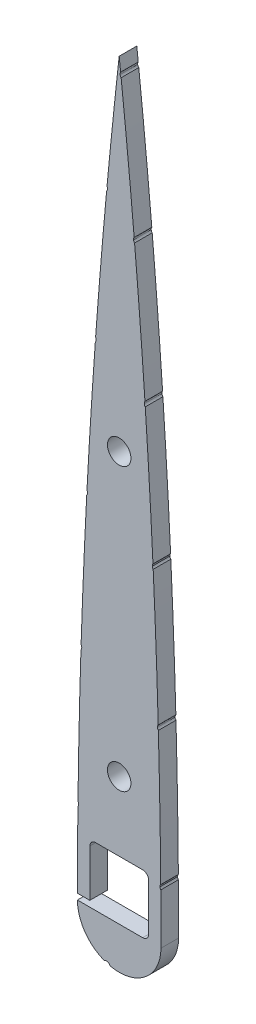
from build123d import *

# Parameters (mm, degrees)
BOSS_EXTRUDE1_DEPTH = 3
CUT_EXTRUDE1_DEPTH  = 10
SKETCH3_R           = 2
SKETCH3_W           = 13.226446019
SKETCH3_H           = 1
CUT_EXTRUDE2_DEPTH  = 10


with BuildPart() as part:
    # Sketch1 → Boss-Extrude1 (new body)
    with BuildSketch(Plane.XY):
        with BuildLine():
            ThreePointArc((13.121375015, 488.277822844), (20.226638173, 481.172559686), (27.331901331, 488.277822844))
            ThreePointArc((27.331901331, 488.277822844), (25.554217038, 552.323799448), (20.226638173, 616.172559686))
            ThreePointArc((20.226638173, 616.172559686), (14.899059308, 552.323799448), (13.121375015, 488.277822844))
        make_face()
        with BuildLine():
            Line((24.226638173, 498.277822844), (16.226638173, 498.277822844))
            ThreePointArc((16.226638173, 498.277822844), (15.519531392, 497.984929625), (15.226638173, 497.277822844))
            Line((15.226638173, 497.277822844), (15.226638173, 489.277822844))
            ThreePointArc((15.226638173, 489.277822844), (15.519531392, 488.570716063), (16.226638173, 488.277822844))
            Line((16.226638173, 488.277822844), (24.226638173, 488.277822844))
            ThreePointArc((24.226638173, 488.277822844), (24.933744954, 488.570716063), (25.226638173, 489.277822844))
            Line((25.226638173, 489.277822844), (25.226638173, 497.277822844))
            ThreePointArc((25.226638173, 497.277822844), (24.933744954, 497.984929625), (24.226638173, 498.277822844))
        make_face(mode=Mode.SUBTRACT)
    extrude(amount=BOSS_EXTRUDE1_DEPTH)

    # Sketch2 → Cut-Extrude1 (cut)
    with BuildSketch(Plane.XY.offset(3)):
        with BuildLine():
            add(Edge.make_bspline(
                [(17.917824518, 480.550113994), (17.879049958, 480.563442129), (17.802525035, 480.589746348), (17.700711898, 480.655079034), (17.613238362, 480.738836562), (17.545617647, 480.840833441), (17.493803609, 480.952626823), (17.46890122, 481.072139339), (17.466402269, 481.194948135), (17.484272992, 481.275029918), (17.493388754, 481.315879218)],
                knots=[0, 0, 0, 0, 1.008999505, 1.991347132, 2.958476684, 3.977839497, 4.99441976, 5.98108309, 6.970161017, 8, 8, 8, 8], degree=3))
            add(Edge.make_bspline(
                [(17.493388754, 481.315879218), (17.506651104, 481.355170807), (17.532681405, 481.432289255), (17.598326154, 481.534540464), (17.682504029, 481.621874617), (17.783956316, 481.69109152), (17.895791033, 481.744135072), (18.014247189, 481.770965238), (18.135773557, 481.773081444), (18.214356613, 481.755353058), (18.254701855, 481.746251147)],
                knots=[0, 0, 0, 0, 1.021718546, 2.005348997, 2.9737415, 4.001367881, 5.024329172, 6.014925073, 6.980844817, 8, 8, 8, 8], degree=3))
            add(Edge.make_bspline(
                [(18.254701855, 481.746251147), (18.293932401, 481.732914986), (18.370283672, 481.706959884), (18.473505916, 481.642576018), (18.558267104, 481.555970566), (18.627081129, 481.454225867), (18.678678349, 481.342206622), (18.703534333, 481.223247245), (18.706140424, 481.101401964), (18.688260927, 481.022321881), (18.679137619, 480.981969964)],
                knots=[0, 0, 0, 0, 1.021990589, 1.98901847, 2.974808984, 3.995774727, 5.013953546, 6.002168387, 6.980573457, 8, 8, 8, 8], degree=3))
            add(Edge.make_bspline(
                [(18.679137619, 480.981969964), (18.665887345, 480.942178578), (18.639888953, 480.864103812), (18.574138528, 480.760572371), (18.490936683, 480.671419911), (18.388361369, 480.603905112), (18.277067295, 480.552137248), (18.15860809, 480.527593086), (18.037272116, 480.522614474), (17.958178639, 480.540823569), (17.917824518, 480.550113994)],
                knots=[0, 0, 0, 0, 1.031014283, 2.022955405, 2.998173182, 4.016768215, 5.032582796, 6.006578686, 6.982940593, 8, 8, 8, 8], degree=3))
        make_face()
        with BuildLine():
            add(Edge.make_bspline(
                [(12.091373886, 502.515681823), (12.093603678, 502.557001147), (12.097956816, 502.63766729), (12.133858983, 502.753359861), (12.191443599, 502.85915034), (12.269765202, 502.95320184), (12.364691341, 503.032011191), (12.471639915, 503.09091371), (12.590515736, 503.124616642), (12.672412485, 503.129195965), (12.714671162, 503.131558893)],
                knots=[0, 0, 0, 0, 1.01693019, 1.985314115, 2.956688424, 3.970102348, 4.983516273, 5.982145833, 6.958788392, 8, 8, 8, 8], degree=3))
            add(Edge.make_bspline(
                [(12.714671162, 503.131558893), (12.755956195, 503.129235023), (12.837029544, 503.12467153), (12.953873331, 503.089727928), (13.059282663, 503.029755894), (13.153603649, 502.951311839), (13.233570108, 502.858169839), (13.290959536, 502.751817819), (13.326952331, 502.63619858), (13.33129294, 502.555522299), (13.333516314, 502.514197782)],
                knots=[0, 0, 0, 0, 1.02132407, 2.005621777, 2.98709575, 4.004888363, 5.030536525, 6.00610788, 6.97867593, 8, 8, 8, 8], degree=3))
            add(Edge.make_bspline(
                [(13.333516314, 502.514197782), (13.331279369, 502.472880608), (13.326912267, 502.392218662), (13.29091072, 502.275848024), (13.232270162, 502.169386904), (13.152004867, 502.075274232), (13.057276131, 501.996989014), (12.950061977, 501.940847348), (12.83423812, 501.904646933), (12.753033199, 501.901437983), (12.711703079, 501.899804753)],
                knots=[0, 0, 0, 0, 1.019629596, 1.990584061, 2.981129565, 4.005076079, 5.03062764, 5.998806182, 6.981470843, 8, 8, 8, 8], degree=3))
            add(Edge.make_bspline(
                [(12.711703079, 501.899804753), (12.669436737, 501.902154035), (12.587525132, 501.906706912), (12.469406662, 501.940414543), (12.362554173, 501.998058405), (12.268335909, 502.07676095), (12.189598312, 502.170978758), (12.132317493, 502.277445596), (12.09836365, 502.393944264), (12.093744215, 502.474398867), (12.091373886, 502.515681823)],
                knots=[0, 0, 0, 0, 1.042416427, 2.020189091, 3.003435257, 4.018021836, 5.032608414, 6.01585458, 6.981893087, 8, 8, 8, 8], degree=3))
        make_face()
        with BuildLine():
            add(Edge.make_bspline(
                [(12.615406431, 525.845411658), (12.618801455, 525.886715869), (12.625433091, 525.96739703), (12.66174154, 526.083296308), (12.722903929, 526.187039287), (12.803351203, 526.278510248), (12.898174869, 526.356136985), (13.007433105, 526.409914552), (13.125969731, 526.442813961), (13.208307444, 526.445215481), (13.250576035, 526.446448316)],
                knots=[0, 0, 0, 0, 1.021067248, 1.994491294, 2.968604708, 3.972804607, 4.989479518, 5.972662446, 6.959253296, 8, 8, 8, 8], degree=3))
            add(Edge.make_bspline(
                [(13.250576035, 526.446448316), (13.291980385, 526.44389581), (13.373063073, 526.438897204), (13.487956379, 526.398882027), (13.594630178, 526.341086822), (13.686084091, 526.258357139), (13.765181542, 526.164113637), (13.821316677, 526.056348462), (13.853688708, 525.939313992), (13.856244353, 525.858477249), (13.857548858, 525.817214876)],
                knots=[0, 0, 0, 0, 1.020907315, 1.999256392, 2.97913271, 4.001796173, 5.02737987, 6.0064165, 6.982393634, 8, 8, 8, 8], degree=3))
            add(Edge.make_bspline(
                [(13.857548858, 525.817214876), (13.854118603, 525.77593238), (13.847418148, 525.695293636), (13.811532933, 525.578845511), (13.747889324, 525.47549723), (13.667199257, 525.382470295), (13.570696884, 525.305935301), (13.462304306, 525.250795637), (13.344933757, 525.218669174), (13.263633818, 525.216032249), (13.222379254, 525.214694176)],
                knots=[0, 0, 0, 0, 1.021360064, 1.995063264, 2.975640288, 3.997365632, 5.023900495, 5.996453334, 6.983327114, 8, 8, 8, 8], degree=3))
            add(Edge.make_bspline(
                [(13.222379254, 525.214694176), (13.18060513, 525.218154472), (13.098530613, 525.22495299), (12.980442981, 525.2606142), (12.87503604, 525.322292477), (12.781799735, 525.401655399), (12.70590743, 525.498032027), (12.652166577, 525.606239462), (12.619143679, 525.723267742), (12.616669402, 525.804134146), (12.615406431, 525.845411658)],
                knots=[0, 0, 0, 0, 1.031706484, 2.027015891, 3.010296948, 4.022279364, 5.029916433, 6.011683584, 6.985082168, 8, 8, 8, 8], degree=3))
        make_face()
        with BuildLine():
            add(Edge.make_bspline(
                [(13.606882641, 549.157394072), (13.61050287, 549.198821617), (13.617555371, 549.279525856), (13.658930742, 549.393436738), (13.718026376, 549.498439676), (13.802722732, 549.587600135), (13.89965487, 549.663040053), (14.009789128, 549.716318352), (14.129003878, 549.747523504), (14.21168844, 549.747866988), (14.253924575, 549.748042443)],
                knots=[0, 0, 0, 0, 1.020248997, 1.987528327, 2.959402107, 3.968455721, 4.99450988, 5.97004364, 6.963077158, 8, 8, 8, 8], degree=3))
            add(Edge.make_bspline(
                [(14.253924575, 549.748042443), (14.295359071, 549.744470101), (14.3767077, 549.737456499), (14.491305331, 549.694850431), (14.596133504, 549.633327149), (14.686809598, 549.550048214), (14.76212584, 549.453397304), (14.817658477, 549.345627001), (14.84828348, 549.227854072), (14.848775294, 549.146678627), (14.849025069, 549.105452632)],
                knots=[0, 0, 0, 0, 1.022883536, 2.008234237, 2.988801837, 4.00949426, 5.028503638, 6.001047132, 6.98480605, 8, 8, 8, 8], degree=3))
            add(Edge.make_bspline(
                [(14.849025069, 549.105452632), (14.845334939, 549.064068062), (14.838146264, 548.983447539), (14.797583199, 548.868451099), (14.733953821, 548.764796952), (14.649962025, 548.673925045), (14.551216728, 548.600126489), (14.44238683, 548.546301165), (14.32420056, 548.517376979), (14.243187657, 548.51665534), (14.201983135, 548.516288303)],
                knots=[0, 0, 0, 0, 1.022392895, 1.991704816, 2.97809575, 4.006523517, 5.027383862, 6.004967558, 6.985293002, 8, 8, 8, 8], degree=3))
            add(Edge.make_bspline(
                [(14.201983135, 548.516288303), (14.160102242, 548.520000322), (14.078044037, 548.527273367), (13.962145796, 548.567529424), (13.856467187, 548.627986833), (13.766229965, 548.710996512), (13.691658409, 548.808305708), (13.638891308, 548.917271794), (13.607472072, 549.034922325), (13.607081167, 549.116144397), (13.606882641, 549.157394072)],
                knots=[0, 0, 0, 0, 1.033502729, 2.024965853, 2.997943477, 4.01716331, 5.027289332, 6.003931093, 6.986270707, 8, 8, 8, 8], degree=3))
        make_face()
        with BuildLine():
            add(Edge.make_bspline(
                [(15.071347074, 572.448169717), (15.076034197, 572.489122878), (15.085240891, 572.569565248), (15.129034887, 572.682716348), (15.191772101, 572.785968487), (15.277063415, 572.87368057), (15.375654984, 572.947149598), (15.486812131, 572.997978807), (15.607150692, 573.02638599), (15.68955234, 573.024793233), (15.731745378, 573.023977676)],
                knots=[0, 0, 0, 0, 1.012095049, 1.988010731, 2.962326238, 3.971185869, 4.983060649, 5.975809561, 6.963531105, 8, 8, 8, 8], degree=3))
            add(Edge.make_bspline(
                [(15.731745378, 573.023977676), (15.772695171, 573.019844619), (15.853666013, 573.011672242), (15.967393915, 572.968049095), (16.07169558, 572.904703235), (16.159612527, 572.818319683), (16.235099909, 572.720505416), (16.285491162, 572.609791124), (16.316307396, 572.491886874), (16.314439261, 572.410760261), (16.313489502, 572.369515537)],
                knots=[0, 0, 0, 0, 1.011577617, 2.000212631, 2.975800792, 4.003234938, 5.023684605, 6.006651877, 6.986582949, 8, 8, 8, 8], degree=3))
            add(Edge.make_bspline(
                [(16.313489502, 572.369515537), (16.308768307, 572.3285845), (16.299494685, 572.248185589), (16.256094192, 572.134470175), (16.19090965, 572.031645616), (16.105325796, 571.942396281), (16.00583114, 571.87007679), (15.895521104, 571.819261138), (15.777135444, 571.791892597), (15.695764138, 571.792112317), (15.65457524, 571.792223536)],
                knots=[0, 0, 0, 0, 1.014338011, 1.992416476, 2.975366335, 4.003734179, 5.027738349, 5.995383679, 6.985294169, 8, 8, 8, 8], degree=3))
            add(Edge.make_bspline(
                [(15.65457524, 571.792223536), (15.612631062, 571.796862611), (15.530719595, 571.805922113), (15.415598435, 571.849865844), (15.311048749, 571.912681471), (15.221073433, 571.997524427), (15.149097559, 572.097614223), (15.097227415, 572.207538697), (15.069063712, 572.326063196), (15.070576756, 572.406975656), (15.071347074, 572.448169717)],
                knots=[0, 0, 0, 0, 1.033942708, 2.019154198, 3.001733942, 4.017266702, 5.036798354, 6.016361729, 6.990092289, 8, 8, 8, 8], degree=3))
        make_face()
        with BuildLine():
            add(Edge.make_bspline(
                [(17.002280489, 595.702331369), (17.007517398, 595.74327257), (17.017816513, 595.823789177), (17.062354574, 595.937230853), (17.129122654, 596.038234352), (17.215528238, 596.125678014), (17.316728143, 596.195942739), (17.428410248, 596.24713545), (17.549891808, 596.270945069), (17.632432917, 596.268830196), (17.674551122, 596.267751041)],
                knots=[0, 0, 0, 0, 1.011145168, 1.988558624, 2.962868331, 3.968519099, 4.990202991, 5.975070542, 6.966740416, 8, 8, 8, 8], degree=3))
            add(Edge.make_bspline(
                [(17.674551122, 596.267751041), (17.71548942, 596.261919577), (17.795917658, 596.250462961), (17.909640728, 596.20584612), (18.01254618, 596.139638029), (18.099557237, 596.051621731), (18.173364349, 595.952858352), (18.221333161, 595.840996232), (18.248183798, 595.722404998), (18.245687706, 595.641120172), (18.244422917, 595.599932531)],
                knots=[0, 0, 0, 0, 1.016206121, 1.996459845, 2.983813118, 4.009625526, 5.03137357, 6.00302407, 6.988117089, 8, 8, 8, 8], degree=3))
            add(Edge.make_bspline(
                [(18.244422917, 595.599932531), (18.239334264, 595.558931211), (18.229304326, 595.47811596), (18.182496393, 595.365385365), (18.115845603, 595.263330676), (18.028589119, 595.17587929), (17.927811117, 595.103857349), (17.815215406, 595.058527573), (17.696696985, 595.030032197), (17.615346573, 595.033975221), (17.573636325, 595.035996901)],
                knots=[0, 0, 0, 0, 1.013875973, 1.998390303, 2.975331333, 4.000933858, 5.025377018, 6.003229941, 6.97620956, 8, 8, 8, 8], degree=3))
            add(Edge.make_bspline(
                [(17.573636325, 595.035996901), (17.531701583, 595.041183989), (17.449710097, 595.051325869), (17.334339883, 595.096036959), (17.231907687, 595.16281282), (17.142944458, 595.248782602), (17.072709735, 595.349819337), (17.023244183, 595.460937911), (16.99906036, 595.580097574), (17.001196658, 595.661189916), (17.002280489, 595.702331369)],
                knots=[0, 0, 0, 0, 1.034864822, 2.023384443, 3.007637215, 4.02174498, 5.043180155, 6.011779463, 6.991294619, 8, 8, 8, 8], degree=3))
        make_face()
        with BuildLine():
            add(Edge.make_bspline(
                [(21.606151704, 613.674996608), (21.60824702, 613.633894764), (21.61234275, 613.553552693), (21.591043714, 613.434225918), (21.543460235, 613.323282489), (21.475648278, 613.221526407), (21.390146424, 613.134120644), (21.290357202, 613.066048459), (21.177869381, 613.018068853), (21.09707154, 613.004990902), (21.055572444, 612.998273851)],
                knots=[0, 0, 0, 0, 1.016949119, 1.987837794, 2.97078766, 3.986776939, 5.000399666, 5.979064506, 6.962014372, 8, 8, 8, 8], degree=3))
            add(Edge.make_bspline(
                [(21.055572444, 612.998273851), (21.01441884, 612.995347455), (20.933406678, 612.989586751), (20.814641652, 613.014494272), (20.701370834, 613.057411293), (20.599291949, 613.126022291), (20.510344024, 613.211197792), (20.441011175, 613.310375134), (20.39263371, 613.421459007), (20.380557239, 613.500908976), (20.374397564, 613.541432906)],
                knots=[0, 0, 0, 0, 1.017996937, 2.003958949, 2.978494688, 4.00553413, 5.028760475, 6.015179833, 6.987630671, 8, 8, 8, 8], degree=3))
            add(Edge.make_bspline(
                [(20.374397564, 613.541432906), (20.372361955, 613.58252227), (20.368358793, 613.663327274), (20.388974946, 613.782859245), (20.43744973, 613.893544054), (20.505382701, 613.994863493), (20.589981435, 614.084407232), (20.691222858, 614.150964067), (20.802535161, 614.19998991), (20.882449171, 614.212972091), (20.923492783, 614.219639703)],
                knots=[0, 0, 0, 0, 1.017406399, 2.000798258, 2.972896542, 3.98934267, 5.012198053, 6.00145414, 6.973552424, 8, 8, 8, 8], degree=3))
            add(Edge.make_bspline(
                [(20.923492783, 614.219639703), (20.965125547, 614.22251944), (21.047088091, 614.228188787), (21.167242725, 614.204004556), (21.280182374, 614.1590981), (21.380813943, 614.089880916), (21.470869179, 614.007205514), (21.537830591, 613.906977627), (21.586451994, 613.795930518), (21.599467154, 613.716032174), (21.606151704, 613.674996608)],
                knots=[0, 0, 0, 0, 1.027989449, 2.023805788, 3.000729072, 4.015307955, 5.02781928, 6.005125536, 6.975438043, 8, 8, 8, 8], degree=3))
        make_face()
        with BuildLine():
            add(Edge.make_bspline(
                [(23.913246578, 590.445978184), (23.914999924, 590.404817499), (23.918456, 590.323684347), (23.89324309, 590.204989639), (23.846262384, 590.093024335), (23.774947284, 589.992462323), (23.687352429, 589.905325709), (23.585035347, 589.838114574), (23.470452404, 589.791973547), (23.38830646, 589.780865863), (23.346342865, 589.775191593)],
                knots=[0, 0, 0, 0, 1.008647345, 1.988177229, 2.95197647, 3.973427005, 4.996033518, 5.970120688, 6.963052491, 8, 8, 8, 8], degree=3))
            add(Edge.make_bspline(
                [(23.346342865, 589.775191593), (23.304682173, 589.773367409), (23.223531054, 589.769814071), (23.103772787, 589.795602654), (22.991845632, 589.843323653), (22.889826392, 589.91325777), (22.802498303, 590.000181645), (22.734212249, 590.101135937), (22.688132131, 590.214542912), (22.676839385, 590.295197288), (22.67110415, 590.336159141)],
                knots=[0, 0, 0, 0, 1.022927375, 1.99256653, 2.985553801, 4.002228239, 5.018319052, 6.001173918, 6.984858293, 8, 8, 8, 8], degree=3))
            add(Edge.make_bspline(
                [(22.67110415, 590.336159141), (22.669116282, 590.377855941), (22.665239205, 590.459180125), (22.69330296, 590.578078589), (22.740425812, 590.689734347), (22.812775169, 590.789959943), (22.900420366, 590.876536871), (23.001133882, 590.945734207), (23.115269876, 590.989490644), (23.195623501, 591.001057935), (23.236523821, 591.006945733)],
                knots=[0, 0, 0, 0, 1.02389329, 1.996970653, 2.979695845, 3.994259616, 5.019965172, 6.003748113, 6.983899731, 8, 8, 8, 8], degree=3))
            add(Edge.make_bspline(
                [(23.236523821, 591.006945733), (23.278678304, 591.008735193), (23.361293311, 591.012242206), (23.481876877, 590.986888251), (23.595139141, 590.940422949), (23.69554526, 590.868636616), (23.783282334, 590.782021249), (23.851971168, 590.681307666), (23.89580812, 590.567247868), (23.907364389, 590.486883813), (23.913246578, 590.445978184)],
                knots=[0, 0, 0, 0, 1.032197202, 2.022916011, 2.997199867, 4.017903909, 5.031140257, 6.011234028, 6.987710091, 8, 8, 8, 8], degree=3))
        make_face()
        with BuildLine():
            add(Edge.make_bspline(
                [(25.738228963, 567.186671986), (25.738873867, 567.145494627), (25.740138872, 567.064723548), (25.713882202, 566.946266594), (25.663801041, 566.835606841), (25.590842634, 566.736689848), (25.503547692, 566.649008974), (25.397961399, 566.587411181), (25.28369066, 566.540983295), (25.201467722, 566.532230356), (25.159452921, 566.527757723)],
                knots=[0, 0, 0, 0, 1.010400582, 1.981942197, 2.956907825, 3.976937045, 4.992528012, 5.975587291, 6.965552691, 8, 8, 8, 8], degree=3))
            add(Edge.make_bspline(
                [(25.159452921, 566.527757723), (25.118291601, 566.52716845), (25.037067441, 566.52600563), (24.917914464, 566.551733299), (24.806835131, 566.602729167), (24.705895285, 566.674464337), (24.6200562, 566.764216549), (24.555335943, 566.867352135), (24.509658913, 566.980409756), (24.50065862, 567.061094409), (24.496086535, 567.102081641)],
                knots=[0, 0, 0, 0, 1.011507555, 1.996020843, 2.972054622, 4.003110375, 5.028608614, 6.008815604, 6.988492445, 8, 8, 8, 8], degree=3))
            add(Edge.make_bspline(
                [(24.496086535, 567.102081641), (24.495309044, 567.143280847), (24.493781912, 567.224203409), (24.522048579, 567.342654065), (24.57335244, 567.452497499), (24.64672496, 567.551497781), (24.73547721, 567.636927492), (24.838688002, 567.70250054), (24.953138982, 567.745263762), (25.033954591, 567.754723464), (25.074862577, 567.759511863)],
                knots=[0, 0, 0, 0, 1.013640227, 1.990969597, 2.97415334, 3.987572963, 5.015233372, 5.99750704, 6.986359773, 8, 8, 8, 8], degree=3))
            add(Edge.make_bspline(
                [(25.074862577, 567.759511863), (25.117014327, 567.760123582), (25.199712926, 567.76132373), (25.320352211, 567.735732586), (25.431833285, 567.685026642), (25.530870565, 567.612184459), (25.617841382, 567.524957862), (25.680484497, 567.421168113), (25.724349934, 567.3080807), (25.733546829, 567.227629594), (25.738228963, 567.186671986)],
                knots=[0, 0, 0, 0, 1.034989411, 2.030572227, 3.005778869, 4.026060244, 5.041902269, 6.014827011, 6.989349644, 8, 8, 8, 8], degree=3))
        make_face()
        with BuildLine():
            add(Edge.make_bspline(
                [(27.096672228, 543.894651202), (27.096933189, 543.85344065), (27.097446396, 543.772395696), (27.068040961, 543.654257149), (27.01435272, 543.545395916), (26.94090788, 543.447315489), (26.851005738, 543.363478048), (26.745979152, 543.301963361), (26.630235363, 543.259719101), (26.547942391, 543.25267927), (26.506023858, 543.24909331)],
                knots=[0, 0, 0, 0, 1.012278585, 1.990753993, 2.966492828, 3.985426641, 4.994692376, 5.972940029, 6.967452766, 8, 8, 8, 8], degree=3))
            add(Edge.make_bspline(
                [(26.506023858, 543.24909331), (26.464786582, 543.248774866), (26.383689074, 543.248148613), (26.265705272, 543.278438226), (26.155187653, 543.329132871), (26.056604123, 543.403923999), (25.972998035, 543.494382627), (25.908449567, 543.597709237), (25.867301517, 543.712250018), (25.858825393, 543.792921986), (25.8545298, 543.833805516)],
                knots=[0, 0, 0, 0, 1.014190945, 1.994514854, 2.977876179, 3.998734926, 5.027161082, 6.003140339, 6.98801686, 8, 8, 8, 8], degree=3))
            add(Edge.make_bspline(
                [(25.8545298, 543.833805516), (25.854882907, 543.875021101), (25.855577156, 543.956055754), (25.884701247, 544.074083278), (25.937721708, 544.183433269), (26.014415369, 544.279754008), (26.103871975, 544.364778278), (26.208985915, 544.425817942), (26.322889547, 544.46868998), (26.403731461, 544.476726975), (26.445178171, 544.48084745)],
                knots=[0, 0, 0, 0, 1.015073626, 1.995753275, 2.973690186, 3.992578788, 5.02137814, 6.001829521, 6.975561218, 8, 8, 8, 8], degree=3))
            add(Edge.make_bspline(
                [(26.445178171, 544.48084745), (26.487368166, 544.48049907), (26.569843587, 544.479818037), (26.689597045, 544.451123157), (26.798944757, 544.397054849), (26.896980178, 544.323155577), (26.981894784, 544.234421127), (27.043777708, 544.130201906), (27.085860196, 544.016400265), (27.093037746, 543.935577347), (27.096672228, 543.894651202)],
                knots=[0, 0, 0, 0, 1.037286792, 2.027747689, 3.003623852, 4.022701075, 5.040392144, 6.008318064, 6.991475854, 8, 8, 8, 8], degree=3))
        make_face()
        with BuildLine():
            add(Edge.make_bspline(
                [(27.982077934, 520.579388591), (27.981443594, 520.538100636), (27.980200381, 520.457182286), (27.946683392, 520.340243413), (27.893155997, 520.231929298), (27.816700118, 520.135677114), (27.724704856, 520.055035434), (27.619398395, 519.993196903), (27.502196032, 519.955554832), (27.419889838, 519.949022074), (27.378073193, 519.945703027)],
                knots=[0, 0, 0, 0, 1.014078848, 1.987446149, 2.969181748, 3.976786433, 4.996715222, 5.969394658, 6.968326673, 8, 8, 8, 8], degree=3))
            add(Edge.make_bspline(
                [(27.378073193, 519.945703027), (27.336802815, 519.946398822), (27.255439856, 519.947770555), (27.137806954, 519.980720887), (27.028939429, 520.035052217), (26.931979265, 520.110497018), (26.849992751, 520.202341558), (26.788667476, 520.306595796), (26.749297536, 520.42190473), (26.743113757, 520.502399856), (26.739935506, 520.543771604)],
                knots=[0, 0, 0, 0, 1.016361831, 2.003718166, 2.987663934, 4.007181377, 5.020230296, 6.011814511, 6.978140518, 8, 8, 8, 8], degree=3))
            add(Edge.make_bspline(
                [(26.739935506, 520.543771604), (26.740598719, 520.585047273), (26.741898519, 520.665941546), (26.775064473, 520.783273442), (26.830478652, 520.891364356), (26.908315855, 520.986984436), (27.000394995, 521.068755266), (27.106075682, 521.128835955), (27.221613548, 521.16795536), (27.302571869, 521.174243851), (27.343940247, 521.177457167)],
                knots=[0, 0, 0, 0, 1.015557795, 1.990344669, 2.979034438, 3.995693268, 5.017109536, 6.001792977, 6.978948902, 8, 8, 8, 8], degree=3))
            add(Edge.make_bspline(
                [(27.343940247, 521.177457167), (27.386213734, 521.176846801), (27.468591372, 521.17565739), (27.587116777, 521.142370252), (27.695914466, 521.088563893), (27.791541462, 521.012092698), (27.8732754, 520.921504228), (27.933792595, 520.816941122), (27.972524206, 520.701689473), (27.978847059, 520.620748238), (27.982077934, 520.579388591)],
                knots=[0, 0, 0, 0, 1.039511397, 2.025678497, 3.008439137, 4.017095875, 5.028924612, 6.002619634, 6.979371311, 8, 8, 8, 8], degree=3))
        make_face()
        with BuildLine():
            add(Edge.make_bspline(
                [(28.400010559, 497.250365819), (28.398216447, 497.209083449), (28.394697441, 497.128111355), (28.360880855, 497.011734141), (28.304152942, 496.904856051), (28.22658206, 496.810504994), (28.132747591, 496.730993011), (28.026558201, 496.672293014), (27.908548661, 496.636548275), (27.826433276, 496.632250514), (27.784133489, 496.630036626)],
                knots=[0, 0, 0, 0, 1.016572735, 1.993926814, 2.960245649, 3.9838273, 4.988609868, 5.977252703, 6.958029832, 8, 8, 8, 8], degree=3))
            add(Edge.make_bspline(
                [(27.784133489, 496.630036626), (27.742844992, 496.631815433), (27.661860879, 496.635304422), (27.545146286, 496.669462918), (27.437875667, 496.725543918), (27.341855048, 496.802429345), (27.262535594, 496.896479489), (27.203371149, 497.002159742), (27.165921338, 497.117833079), (27.160593746, 497.198637631), (27.157868131, 497.239977531)],
                knots=[0, 0, 0, 0, 1.019309872, 1.999295491, 2.979051865, 3.997700396, 5.022431777, 6.003028455, 6.978342161, 8, 8, 8, 8], degree=3))
            add(Edge.make_bspline(
                [(27.157868131, 497.239977531), (27.159495018, 497.28131277), (27.162691506, 497.362527749), (27.198982424, 497.478278561), (27.254603905, 497.585428414), (27.33388236, 497.67884567), (27.427387605, 497.759085928), (27.533917897, 497.817787917), (27.650364829, 497.85334604), (27.730955771, 497.858929214), (27.77226116, 497.861790765)],
                knots=[0, 0, 0, 0, 1.019574454, 2.003247607, 2.972419772, 3.989566577, 5.014563948, 6.006126031, 6.978076969, 8, 8, 8, 8], degree=3))
            add(Edge.make_bspline(
                [(27.77226116, 497.861790765), (27.814520801, 497.860005698), (27.896936931, 497.856524402), (28.015668128, 497.822946686), (28.123118459, 497.764666406), (28.218059255, 497.686490927), (28.298713977, 497.593778951), (28.357714675, 497.488381227), (28.393358921, 497.372322967), (28.397757494, 497.29167555), (28.400010559, 497.250365819)],
                knots=[0, 0, 0, 0, 1.039104311, 2.026495097, 3.007627205, 4.029445514, 5.040383396, 6.016662139, 6.984082099, 8, 8, 8, 8], degree=3))
        make_face()
    extrude(amount=-CUT_EXTRUDE1_DEPTH, mode=Mode.SUBTRACT)

    # Sketch3 → Cut-Extrude2 (cut)
    with BuildSketch(Plane.XY.offset(3)):
        with Locations((20.226638173, 510.011236626)):
            Circle(SKETCH3_R)
        with Locations((20.226638173, 557.919674474)):
            Circle(SKETCH3_R)
        with Locations((13.613415164, 488.777822844)):
            Rectangle(SKETCH3_W, SKETCH3_H)
    extrude(amount=-CUT_EXTRUDE2_DEPTH, mode=Mode.SUBTRACT)


solid = part.part
